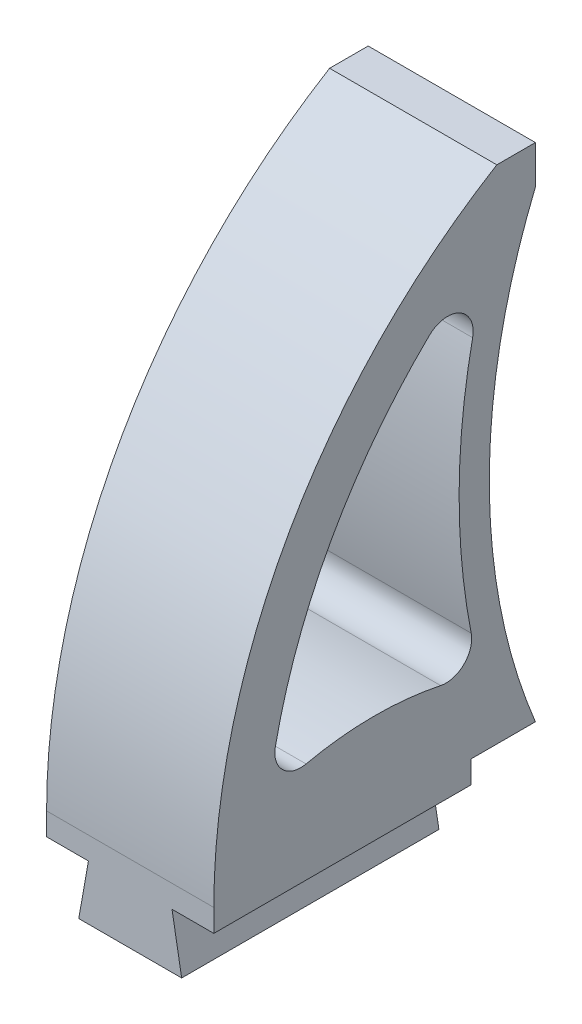
from build123d import *

# Parameters (mm, degrees)
EXTRUDE_1_DEPTH     = 6.5
CUT_EXTRUDE_2_REACH = 53.887
CUT_EXTRUDE_3_REACH = 55.094


with BuildPart() as part:
    # 草图1 → 凸台-拉伸1 (new, symmetric)
    with BuildSketch(Plane(origin=(0, 0, 0), x_dir=(0, 0, -1), z_dir=(1, 0, 0))):
        with BuildLine():
            Line((0, 0), (0, 6))
            ThreePointArc((0, 6), (5.87927664, 28.388613177), (22, 45))
            Line((22, 45), (25, 45))
            Line((25, 45), (25, 42))
            ThreePointArc((25, 42), (21.416586692, 24), (25, 6))
            Line((25, 6), (20, 6))
            Line((20, 6), (20, 0))
            Line((20, 0), (0, 0))
        make_face()
    extrude(amount=EXTRUDE_1_DEPTH, both=True)

    # 草图2 → 切除-拉伸2 (cut, up to next)
    with BuildSketch(Plane.XY, mode=Mode.PRIVATE) as cut_extrude_2_sk1:
        Polygon((-6.5, 0), (-4, 0), (-3.25, 4.253461365), (-6.5, 4.253461365), align=None)
    cut_extrude_2_tool1 = extrude(cut_extrude_2_sk1.sketch, amount=-CUT_EXTRUDE_2_REACH, mode=Mode.PRIVATE) & part.part
    # 草图2 → 切除-拉伸2 (cut, up to next)
    with BuildSketch(Plane.XY, mode=Mode.PRIVATE) as cut_extrude_2_sk2:
        Polygon((6.5, 0), (4, 0), (3.25, 4.253461365), (6.5, 4.253461365), align=None)
    cut_extrude_2_tool2 = extrude(cut_extrude_2_sk2.sketch, amount=-CUT_EXTRUDE_2_REACH, mode=Mode.PRIVATE) & part.part
    add(cut_extrude_2_tool1.solids().sort_by_distance((-5.054348, 2.219197, 0))[0], mode=Mode.SUBTRACT)
    add(cut_extrude_2_tool2.solids().sort_by_distance((5.054348, 2.219197, 0))[0], mode=Mode.SUBTRACT)

    # 草图3 → 切除-拉伸3 (cut, up to next)
    with BuildSketch(Plane(origin=(6.5, 0, 0), x_dir=(0, 0, -1), z_dir=(1, 0, 0)), mode=Mode.PRIVATE) as cut_extrude_3_sk1:
        with BuildLine():
            ThreePointArc((7.169736852, 12.07909507), (12.400276965, 12.65373917), (17.63523501, 12.120841452))
            ThreePointArc((17.63523501, 12.120841452), (19.45114939, 12.654920589), (20.008524733, 14.463820333))
            ThreePointArc((20.008524733, 14.463820333), (19.071107342, 24.389014044), (20.121422197, 34.302896243))
            ThreePointArc((20.121422197, 34.302896243), (19.130864623, 36.4613018), (16.77629627, 36.151581393))
            ThreePointArc((16.77629627, 36.151581393), (9.141463638, 26.201122888), (4.785137328, 14.439970103))
            ThreePointArc((4.785137328, 14.439970103), (5.336190032, 12.611841621), (7.169736852, 12.07909507))
        make_face()
    cut_extrude_3_tool1 = extrude(cut_extrude_3_sk1.sketch, amount=-CUT_EXTRUDE_3_REACH, mode=Mode.PRIVATE) & part.part
    add(cut_extrude_3_tool1.solids().sort_by_distance((6.5, 22.129704, -13.663141))[0], mode=Mode.SUBTRACT)


solid = part.part
